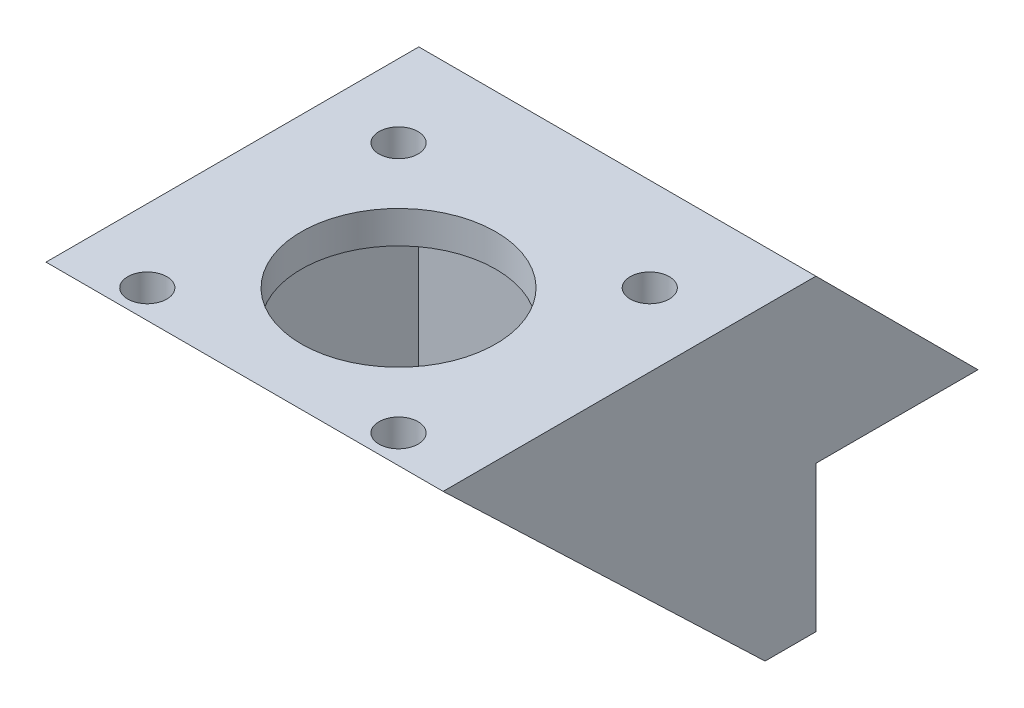
from build123d import *

# Parameters (mm, degrees)
SKETCH_1_W          = 49
SKETCH_1_H          = 66
EXTRUDE_1_DEPTH     = 44
SKETCH_2_W          = 42
SKETCH_2_H          = 40
CUT_EXTRUDE_1_DEPTH = 42
SKETCH_3_W          = 20
SKETCH_3_H          = 24
CUT_EXTRUDE_2_DEPTH = 50
SKETCH_5_R          = 12
SKETCH_5_R_2        = 2.408268243
SKETCH_5_R_3        = 4.25
CUT_EXTRUDE_3_DEPTH = 50
SKETCH_7_R          = 5
CUT_EXTRUDE_4_DEPTH = 18
SKETCH_8_W          = 49
SKETCH_8_H          = 6
CUT_EXTRUDE_5_DEPTH = 18


with BuildPart() as part:
    # 草圖1 → 填料-伸長1 (new body)
    with BuildSketch(Plane(origin=(0, 0, 0), x_dir=(1, 0, 0), z_dir=(0, 1, 0))):
        Rectangle(SKETCH_1_W, SKETCH_1_H)
    extrude(amount=EXTRUDE_1_DEPTH)

    # 草圖2 → 除料-伸長1 (cut)
    with BuildSketch(Plane.XY.offset(33)):
        with Locations((0.48895233, 20)):
            Rectangle(SKETCH_2_W, SKETCH_2_H)
    extrude(amount=-CUT_EXTRUDE_1_DEPTH, mode=Mode.SUBTRACT)

    # 草圖3 → 除料-伸長2 (cut)
    with BuildSketch(Plane.ZY.offset(24.5)):
        Polygon((-33, 24), (-13, 44), (-33, 44), align=None)
        with Locations((-23, 12)):
            Rectangle(SKETCH_3_W, SKETCH_3_H)
        Polygon((33, 0), (33, 44), (-13, 0), align=None)
    extrude(amount=-CUT_EXTRUDE_2_DEPTH, mode=Mode.SUBTRACT)

    # 草圖5 → 除料-伸長3 (cut)
    with BuildSketch(Plane(origin=(0, 44, 0), x_dir=(1, 0, 0), z_dir=(0, 1, 0))):
        with Locations((0, -14)):
            Circle(SKETCH_5_R)
        with Locations((15.5, 1.5)):
            Circle(SKETCH_5_R_2)
        with Locations((10.5, 23)):
            Circle(SKETCH_5_R_3)
        with Locations((-10.5, 23)):
            Circle(SKETCH_5_R_3)
        with Locations((15.5, -29.5)):
            Circle(SKETCH_5_R_2)
        with Locations((-15.5, -29.5)):
            Circle(SKETCH_5_R_2)
        with Locations((-15.5, 1.5)):
            Circle(SKETCH_5_R_2)
    extrude(amount=-CUT_EXTRUDE_3_DEPTH, mode=Mode.SUBTRACT)

    # 草圖7 → 除料-伸長4 (cut)
    with BuildSketch(Plane(origin=(0, 44, 0), x_dir=(1, 0, 0), z_dir=(0, 1, 0))):
        with Locations((10.5, 23)):
            Circle(SKETCH_7_R)
        with Locations((-10.5, 23)):
            Circle(SKETCH_7_R)
    extrude(amount=-CUT_EXTRUDE_4_DEPTH, mode=Mode.SUBTRACT)

    # 草圖8 → 除料-伸長5 (cut)
    with BuildSketch(Plane(origin=(0, 0, -13), x_dir=(-1, 0, 0), z_dir=(0, 0, -1))):
        with Locations((0, 3)):
            Rectangle(SKETCH_8_W, SKETCH_8_H)
    extrude(amount=-CUT_EXTRUDE_5_DEPTH, mode=Mode.SUBTRACT)


solid = part.part
